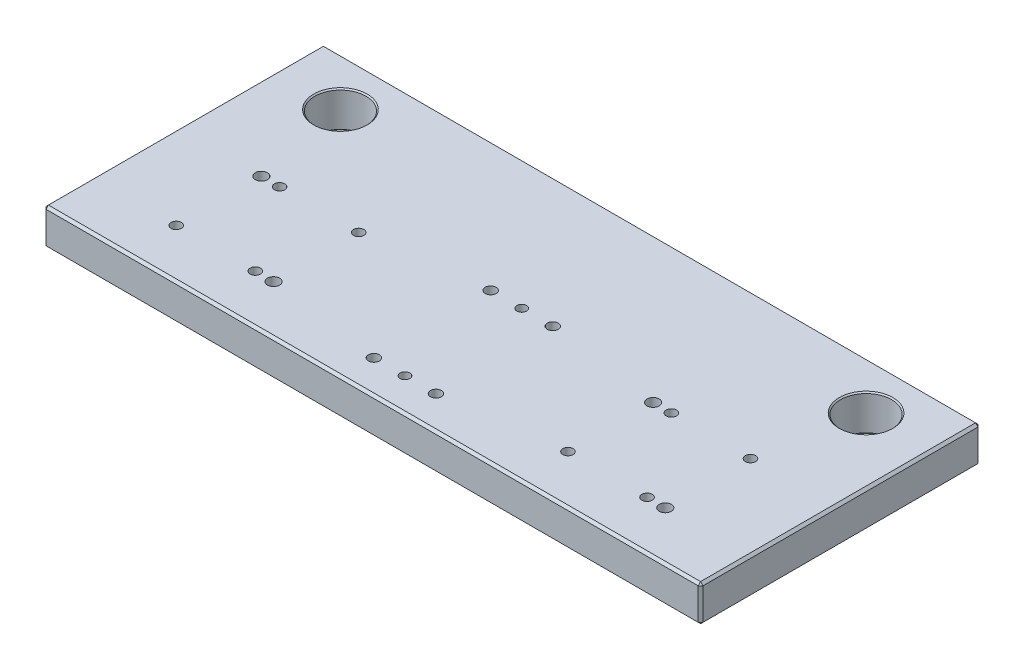
from build123d import *

# Parameters (mm, degrees)
SKETCH2_W                                           = 540
SKETCH2_H                                           = 150
BOSS_EXTRUDE1_DEPTH                                 = 30
SKETCH3_W                                           = 540
SKETCH3_H                                           = 30
BOSS_EXTRUDE2_DEPTH                                 = 80
SKETCH6_R                                           = 21
CUT_EXTRUDE1_DEPTH                                  = 313.769883461
CHAMFER1_SIZE                                       = 2
CHAMFER2_SIZE                                       = 1
M10_TAPPED_HOLE1_D                                  = 8.5
F_10_0MM_DOWEL_HOLE1_D                              = 10
CIRPATTERN1_COUNT                                   = 2
CBORE_FOR_M8_HEX_SOCKET_HEAD_CAP_SCREW1_D           = 9
CBORE_FOR_M8_HEX_SOCKET_HEAD_CAP_SCREW1_CBORE_D     = 15
CBORE_FOR_M8_HEX_SOCKET_HEAD_CAP_SCREW1_CBORE_DEPTH = 8.6
F_8_0MM_DOWEL_HOLE1_D                               = 8


with BuildPart() as part:
    # Sketch2 → Boss-Extrude1 (new body)
    with BuildSketch(Plane(origin=(0, 0, 0), x_dir=(1, 0, 0), z_dir=(0, 1, 0))):
        Rectangle(SKETCH2_W, SKETCH2_H)
    extrude(amount=-BOSS_EXTRUDE1_DEPTH)

    # Sketch3 → Boss-Extrude2 (add)
    with BuildSketch(Plane(origin=(0, 0, -75), x_dir=(-1, 0, 0), z_dir=(0, 0, -1))):
        with Locations((0, -15)):
            Rectangle(SKETCH3_W, SKETCH3_H)
    extrude(amount=BOSS_EXTRUDE2_DEPTH)

    # Sketch6 → Cut-Extrude1 (cut, through all)
    with BuildSketch(Plane(origin=(0, 0, 0), x_dir=(1, 0, 0), z_dir=(0, 1, 0))):
        with Locations((-216, 115)):
            Circle(SKETCH6_R)
    cut_extrude1 = extrude(amount=-CUT_EXTRUDE1_DEPTH, mode=Mode.SUBTRACT)

    # Mirror1: Cut-Extrude1 across plane
    add(cut_extrude1.mirror(Plane(origin=(0, 0, 0), x_dir=(0, 0, 1), z_dir=(1, 0, 0))), mode=Mode.SUBTRACT)

    # Chamfer1
    chamfer1_edges = [part.edges().sort_by_distance(p)[0] for p in [
        (270, -30, -40),
        (270, 0, -40),
        (0, -30, -155),
        (270, -15, -155),
        (0, 0, -155),
        (-270, -30, -40),
        (-270, -15, -155),
        (-270, 0, -40),
        (270, -15, 75),
        (0, -30, 75),
        (-270, -15, 75),
        (0, 0, 75),
    ]]
    chamfer(chamfer1_edges, length=CHAMFER1_SIZE)

    # Chamfer2
    chamfer2_edges = [part.edges().sort_by_distance(p)[0] for p in [
        (-237, -30, -115),
        (237, -30, -115),
        (237, 0, -115),
        (-237, 0, -115),
    ]]
    chamfer(chamfer2_edges, length=CHAMFER2_SIZE)

    # M10 Tapped Hole1 (through all)
    with Locations(Plane(origin=(0, 0, 0), x_dir=(1, 0, 0), z_dir=(0, 1, 0))):
        with Locations((-121, 35), (-186, 35), (-136, -35), (-201, -35)):
            m10_tapped_hole1 = Hole(M10_TAPPED_HOLE1_D / 2)

    # Ø10.0mm Dowel Hole1 (through all)
    with Locations(Plane(origin=(0, 0, 0), x_dir=(1, 0, 0), z_dir=(0, 1, 0))):
        with Locations((-121, -35), (-201, 35)):
            f_10_0mm_dowel_hole1 = Hole(F_10_0MM_DOWEL_HOLE1_D / 2)

    # CirPattern1: M10 Tapped Hole1, Ø10.0mm Dowel Hole1 ×2 about axis
    cirpattern1_axis = Axis((0, -70, 0), (0, 1, 0))
    add([m10_tapped_hole1.rotate(cirpattern1_axis, i * 360 / CIRPATTERN1_COUNT) for i in range(1, CIRPATTERN1_COUNT)], mode=Mode.SUBTRACT)
    add([f_10_0mm_dowel_hole1.rotate(cirpattern1_axis, i * 360 / CIRPATTERN1_COUNT) for i in range(1, CIRPATTERN1_COUNT)], mode=Mode.SUBTRACT)

    # CBORE for M8 Hex Socket Head Cap Screw1 (through all)
    with Locations(Plane(origin=(0, -30, 0), x_dir=(-1, 0, 0), z_dir=(0, -1, 0))):
        with Locations((25.5, 48), (-25.5, 48), (-25.5, -48), (25.5, -48)):
            CounterBoreHole(CBORE_FOR_M8_HEX_SOCKET_HEAD_CAP_SCREW1_D / 2, CBORE_FOR_M8_HEX_SOCKET_HEAD_CAP_SCREW1_CBORE_D / 2, CBORE_FOR_M8_HEX_SOCKET_HEAD_CAP_SCREW1_CBORE_DEPTH)

    # Ø8.0mm Dowel Hole1 (through all)
    with Locations(Plane(origin=(0, 0, 0), x_dir=(1, 0, 0), z_dir=(0, 1, 0))):
        with Locations((0, -48), (0, 48)):
            Hole(F_8_0MM_DOWEL_HOLE1_D / 2)


solid = part.part
